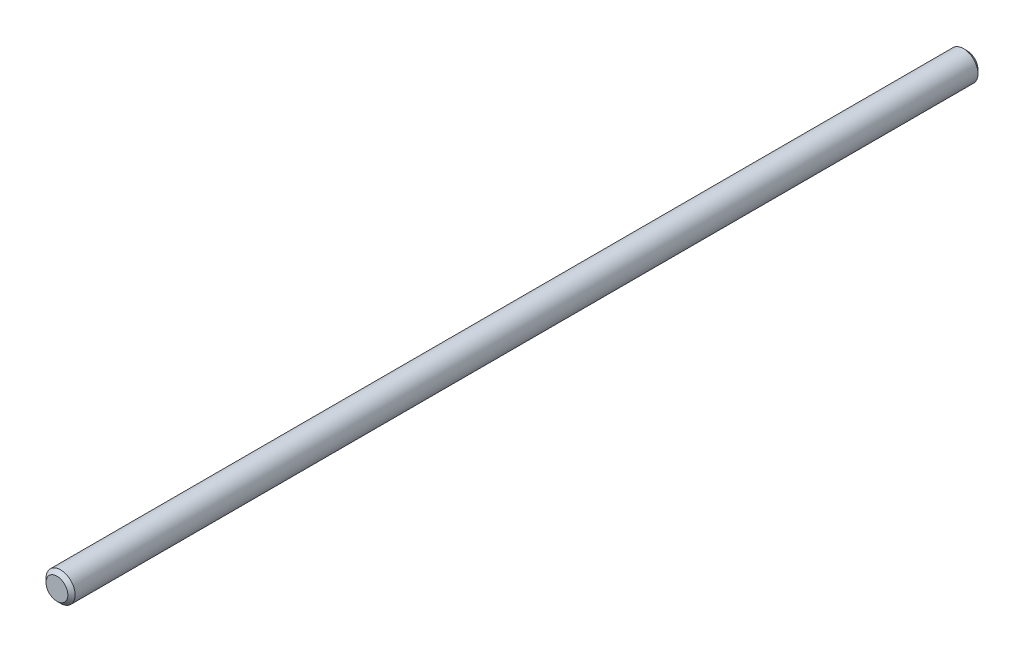
from build123d import *

# Parameters (mm, degrees)
SCHIZZO1_R                   = 4
ESTRUSIONE_ESTRUSIONE1_DEPTH = 250
SMUSSO1_SIZE                 = 1


with BuildPart() as part:
    # Schizzo1 → Estrusione-Estrusione1 (new body)
    with BuildSketch(Plane.XY):
        Circle(SCHIZZO1_R)
    extrude(amount=ESTRUSIONE_ESTRUSIONE1_DEPTH)

    # Smusso1
    smusso1_edges = [part.edges().sort_by_distance(p)[0] for p in [
        (-4, 0, 0),
        (-4, 0, 250),
    ]]
    chamfer(smusso1_edges, length=SMUSSO1_SIZE)


solid = part.part
